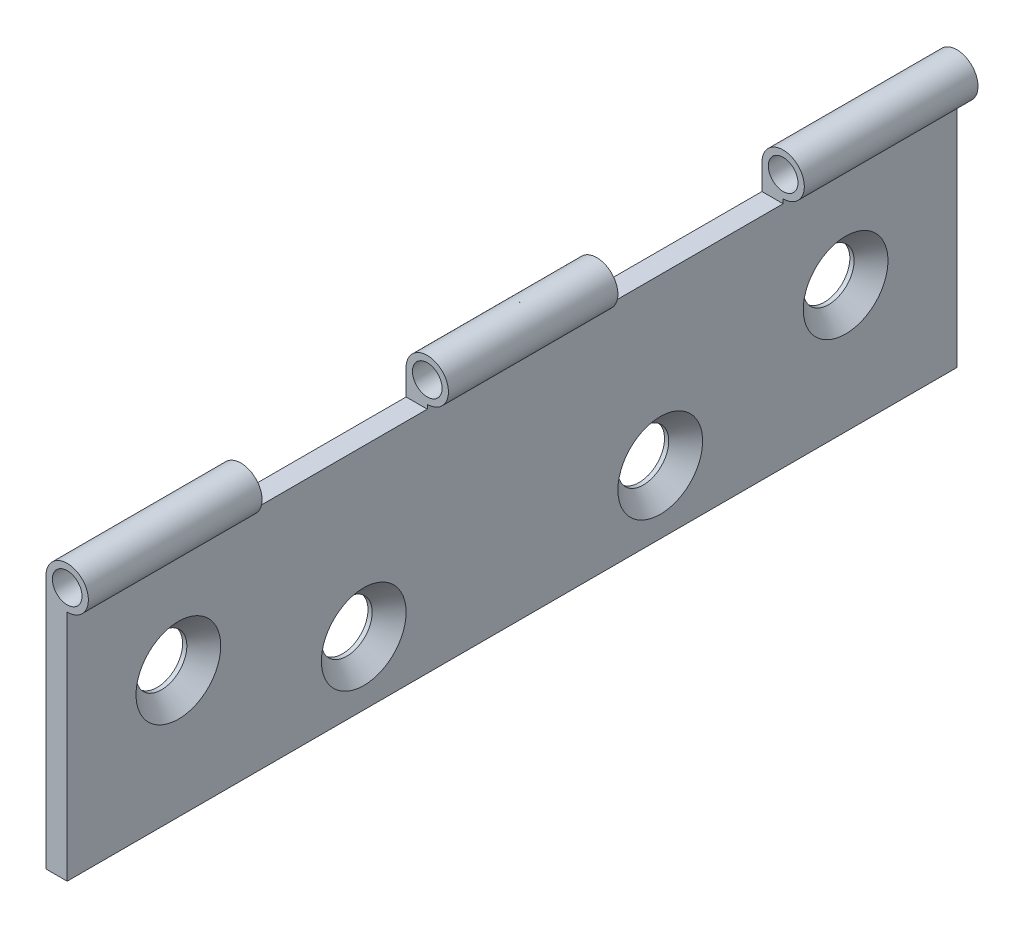
from build123d import *

# Parameters (mm, degrees)
SKETCH_1_W                  = 5
SKETCH_1_H                  = 60
EXTRUDE_2_DEPTH             = 105
SKETCH_2_R                  = 5
SKETCH_3_R                  = 3.5
CUT_EXTRUDE_1_DEPTH         = 221.056810847
HOLE_WIZARD_M101_AT_2_COUNT = 2
HOLE_WIZARD_M101_AT_2_PITCH = 46.25
VIR_2_DEPTH                 = 124.592070943
VIR_2_DEPTH_BACK            = 124.592070943
SKETCH_12_W                 = 44
SKETCH_12_H                 = 11


with BuildPart() as part:
    # Эскиз1 → Вытянуть-Тонкостенный2 (new, symmetric)
    with BuildSketch(Plane.XY):
        with Locations((2.5, 30)):
            Rectangle(SKETCH_1_W, SKETCH_1_H)
    extrude(amount=EXTRUDE_2_DEPTH, both=True)

    # По траектории1: sweep along a curve in space
    with BuildLine() as sweep_1_path:
        Line((0, 60, 105), (0, 60, -105))
    # Эскиз2 → По траектории1 (sweep)
    with BuildSketch(Plane.XY.offset(105)):
        with Locations((5, 60)):
            Circle(SKETCH_2_R)
    sweep(path=sweep_1_path.line)

    # Эскиз3 → Вырез-Вытянуть1 (cut, through all)
    with BuildSketch(Plane.XY.offset(105)):
        with Locations((5, 60)):
            Circle(SKETCH_3_R)
    extrude(amount=-CUT_EXTRUDE_1_DEPTH, mode=Mode.SUBTRACT)

    # Эскиз8 → Зенковка для  винта с плоской головкой M101 (revolve, cut)
    with BuildSketch(Plane(origin=(5, 30, 78.75), x_dir=(0, 0, -1), z_dir=(0, 1, 0))):
        Polygon((0, 0), (0, 5), (6, 5), (6, 4), (10, 0), align=None)
    hole_wizard_m101 = revolve(axis=Axis((11.35, 30, 78.75), (-1, 0, 0)), mode=Mode.SUBTRACT)

    # Зенковка для  винта с плоской головкой M101 at 2: Зенковка для  винта с плоской головкой M101 ×2
    with Locations(*[Vector(0, -0.3243243243243243, -0.945945945945946) * (i * HOLE_WIZARD_M101_AT_2_PITCH) for i in range(1, HOLE_WIZARD_M101_AT_2_COUNT)]):
        add(hole_wizard_m101, mode=Mode.SUBTRACT)

    # Зеркальное отражение1: Зенковка для  винта с плоской головкой M101 across plane
    add(hole_wizard_m101.mirror(Plane.XY), mode=Mode.SUBTRACT)

    # Зеркальное отражение1 copy 1 sketch → Зеркальное отражение1 copy 1 (revolve, cut)
    with BuildSketch(Plane(origin=(5, 15, -35), x_dir=(0, 0, 1), z_dir=(0, 1, 0))):
        Polygon((0, 0), (0, -5), (6, -5), (6, -4), (10, 0), align=None)
    revolve(axis=Axis((11.35, 15, -35), (1, 0, 0)), mode=Mode.SUBTRACT)

    # Эскиз12 → vir_2 (cut, two sides: drawn at the far end of the back side and taken through both)
    with BuildSketch(Plane(origin=(5, 0, 0), x_dir=(0, 0, -1), z_dir=(1, 0, 0)).offset(-VIR_2_DEPTH_BACK)):
        with Locations((-42, 59.5)):
            Rectangle(SKETCH_12_W, SKETCH_12_H)
        with Locations((42, 59.5)):
            Rectangle(SKETCH_12_W, SKETCH_12_H)
    extrude(amount=VIR_2_DEPTH + VIR_2_DEPTH_BACK, mode=Mode.SUBTRACT)


solid = part.part
